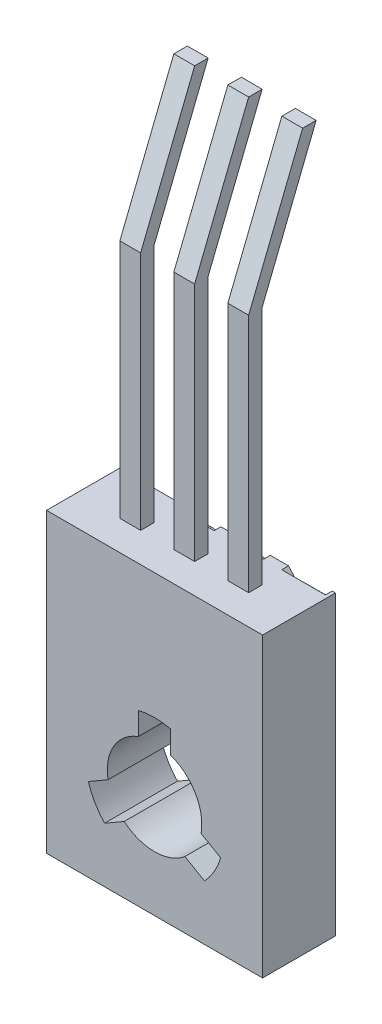
from build123d import *

# Parameters (mm, degrees)
SKETCH1_W           = 8
SKETCH1_H           = 11
SKETCH1_R           = 2.555
BOSS_EXTRUDE1_DEPTH = 1.35
SKETCH2_W           = 0.77
SKETCH2_H           = 0.5
BOSS_EXTRUDE2_DEPTH = 8.9
BOSS_EXTRUDE3_DEPTH = 2.7
CUT_EXTRUDE1_DEPTH  = 0.25
SKETCH8_W           = 0.77
SKETCH8_H           = 0.5


with BuildPart() as part:
    # Sketch1 → Boss-Extrude1 (new, symmetric)
    with BuildSketch(Plane.XY):
        Rectangle(SKETCH1_W, SKETCH1_H)
        with Locations(Location((0, -1.7, 0), (0, 0, 180))):
            Circle(SKETCH1_R, mode=Mode.SUBTRACT)
    extrude(amount=BOSS_EXTRUDE1_DEPTH, both=True)

    # Sketch2 → Boss-Extrude2 (add)
    with BuildSketch(Plane(origin=(0, 5.5, 0), x_dir=(1, 0, 0), z_dir=(0, 1, 0))):
        Rectangle(SKETCH2_W, SKETCH2_H)
        with Locations((-2, 0)):
            Rectangle(SKETCH2_W, SKETCH2_H)
        with Locations((2, 0)):
            Rectangle(SKETCH2_W, SKETCH2_H)
    extrude(amount=BOSS_EXTRUDE2_DEPTH)

    # Sketch4 → Boss-Extrude3 (add)
    with BuildSketch(Plane.XY.offset(1.35)):
        with BuildLine():
            Line((-0.6, 0.823242633), (-0.6, -0.056071778))
            ThreePointArc((-0.6, -0.056071778), (-1.515544457, -0.825), (-1.723683602, -2.002348869))
            Line((-1.723683602, -2.002348869), (-2.48519222, -2.442006074))
            ThreePointArc((-2.48519222, -2.442006074), (-2.246122223, -0.40320073), (-0.6, 0.823242633))
        make_face()
        with BuildLine():
            Line((0.6, 0.823242633), (0.6, -0.056071778))
            ThreePointArc((0.6, -0.056071778), (1.515544457, -0.825), (1.723683602, -2.002348869))
            Line((1.723683602, -2.002348869), (2.48519222, -2.442006074))
            ThreePointArc((2.48519222, -2.442006074), (2.246122223, -0.40320073), (0.6, 0.823242633))
        make_face()
        with BuildLine():
            Line((1.88519222, -3.481236559), (1.123683602, -3.041579353))
            ThreePointArc((1.123683602, -3.041579353), (0, -3.45), (-1.123683602, -3.041579353))
            Line((-1.123683602, -3.041579353), (-1.88519222, -3.481236559))
            ThreePointArc((-1.88519222, -3.481236559), (0, -4.29359854), (1.88519222, -3.481236559))
        make_face()
    extrude(amount=-BOSS_EXTRUDE3_DEPTH)

    # Sketch5 → Cut-Extrude1 (cut)
    # profile 1 of 4: a face of its own
    with BuildSketch(Plane(origin=(0, 0, -1.35), x_dir=(-1, 0, 0), z_dir=(0, 0, -1))):
        with BuildLine():
            Line((-2.565144231, 3.851442308), (-2.351442308, 3.851442308))
            add(Edge.make_bspline(
                [(-2.351442308, 3.851442308), (-2.352834866, 3.823091082), (-2.355569813, 3.767410029), (-2.368383128, 3.686229134), (-2.386700406, 3.60862398), (-2.412660261, 3.535259888), (-2.444718414, 3.465260463), (-2.48396687, 3.399555216), (-2.529568916, 3.337492029), (-2.581440894, 3.280245966), (-2.63772677, 3.227915907), (-2.698089305, 3.182248012), (-2.761908087, 3.14410457), (-2.828629577, 3.112044128), (-2.899025431, 3.088008093), (-2.972422742, 3.070165916), (-3.049153259, 3.059432938), (-3.101431858, 3.05827912), (-3.128019832, 3.057692308)],
                knots=[0, 0, 0, 0, 1.100776268, 2.161895295, 3.184016182, 4.190939212, 5.176500551, 6.166955529, 7.155448256, 8.160289653, 9.16017456, 10.133824356, 11.091467644, 12.04088621, 13.000931625, 13.972173743, 14.968683325, 16, 16, 16, 16], degree=3))
            add(Edge.make_bspline(
                [(-3.128019832, 3.057692308), (-3.154132466, 3.058298618), (-3.20544286, 3.059489997), (-3.280298343, 3.069875086), (-3.351728426, 3.085789309), (-3.418923594, 3.10937168), (-3.482573456, 3.138962397), (-3.541889923, 3.175762331), (-3.598307328, 3.218030232), (-3.649056804, 3.267887294), (-3.695676319, 3.321084906), (-3.735859523, 3.377899507), (-3.770465614, 3.436647555), (-3.798789619, 3.497787956), (-3.820260474, 3.561519813), (-3.83616832, 3.627232108), (-3.845262104, 3.695683204), (-3.846650102, 3.742021319), (-3.847355769, 3.765579928)],
                knots=[0, 0, 0, 0, 1.111674182, 2.184400057, 3.212814286, 4.223731311, 5.211378316, 6.196328225, 7.191884489, 8.207283132, 9.220262353, 10.201199469, 11.166417575, 12.120932471, 13.06540007, 14.026332106, 14.996573967, 16, 16, 16, 16], degree=3))
            add(Edge.make_bspline(
                [(-3.847355769, 3.765579928), (-3.846203728, 3.798745851), (-3.843919861, 3.864495682), (-3.824384095, 3.961116718), (-3.793871441, 4.054728587), (-3.757137209, 4.130072069), (-3.720069206, 4.190776967), (-3.686698963, 4.240783057), (-3.647411405, 4.294612004), (-3.602542189, 4.352481678), (-3.551318603, 4.413634228), (-3.495071429, 4.47931733), (-3.432348063, 4.548316458), (-3.388363905, 4.595474494), (-3.365572416, 4.619910607)],
                knots=[0, 0, 0, 0, 1.184416499, 2.348048165, 3.509039915, 4.696071444, 5.333504901, 6.05069495, 6.844171097, 7.714965912, 8.667477798, 9.695072654, 10.805644396, 12, 12, 12, 12], degree=3))
            Line((-3.365572416, 4.619910607), (-2.769782903, 5.255769231))
            Line((-2.769782903, 5.255769231), (-3.877884615, 5.255769231))
            Line((-3.877884615, 5.255769231), (-3.877884615, 5.5))
            Line((-3.877884615, 5.5), (-2.259855769, 5.5))
            Line((-2.259855769, 5.5), (-3.183353365, 4.514490685))
            add(Edge.make_bspline(
                [(-3.183353365, 4.514490685), (-3.205839323, 4.491020796), (-3.249030246, 4.445939942), (-3.31009352, 4.380103336), (-3.365026379, 4.319097523), (-3.413865261, 4.262652174), (-3.456650353, 4.211087279), (-3.49324476, 4.163998737), (-3.523810223, 4.121790649), (-3.556203245, 4.072206352), (-3.587092141, 4.011595014), (-3.61424032, 3.937897371), (-3.630675458, 3.861863655), (-3.632657075, 3.810497881), (-3.633653846, 3.784660457)],
                knots=[0, 0, 0, 0, 1.329530082, 2.553755191, 3.672934919, 4.687409497, 5.60679272, 6.413407421, 7.126401618, 7.737995624, 8.834647426, 9.90044882, 10.943907757, 12, 12, 12, 12], degree=3))
            add(Edge.make_bspline(
                [(-3.633653846, 3.784660457), (-3.633225757, 3.768410781), (-3.632382076, 3.736385791), (-3.624795144, 3.689462992), (-3.613648436, 3.644024979), (-3.596467914, 3.600633561), (-3.57582615, 3.558435313), (-3.549454774, 3.518713193), (-3.519319217, 3.480113169), (-3.484363448, 3.443958804), (-3.445988509, 3.410835792), (-3.405441819, 3.381496641), (-3.362545574, 3.356977011), (-3.317478542, 3.336876925), (-3.270366917, 3.321109377), (-3.221119432, 3.310183811), (-3.169872201, 3.30332412), (-3.134879055, 3.302395996), (-3.117048528, 3.301923077)],
                knots=[0, 0, 0, 0, 0.991504627, 1.954065223, 2.895985987, 3.842598665, 4.797835564, 5.759220273, 6.74786863, 7.784730864, 8.824135544, 9.839918996, 10.835834653, 11.835434876, 12.84861661, 13.863796685, 14.911511676, 16, 16, 16, 16], degree=3))
            add(Edge.make_bspline(
                [(-3.117048528, 3.301923077), (-3.098421829, 3.302390211), (-3.061842069, 3.303307585), (-3.008250293, 3.310260523), (-2.956767654, 3.320790393), (-2.908187486, 3.33755386), (-2.861493091, 3.357173308), (-2.817875667, 3.382577042), (-2.776109946, 3.411604737), (-2.737035641, 3.445449185), (-2.701447392, 3.48365447), (-2.669072444, 3.525240247), (-2.64164083, 3.570943748), (-2.617290062, 3.619668304), (-2.598666533, 3.672752581), (-2.582744749, 3.728898337), (-2.571179397, 3.78890664), (-2.567189365, 3.830250867), (-2.565144231, 3.851442308)],
                knots=[0, 0, 0, 0, 1.031072318, 2.024855787, 2.988461151, 3.935103592, 4.865765533, 5.788564469, 6.724086513, 7.67908574, 8.64457978, 9.611397706, 10.591395687, 11.591555111, 12.622101007, 13.700900657, 14.821571223, 16, 16, 16, 16], degree=3))
        make_face()
    # profile 2 of 4: a face of its own
    with BuildSketch(Plane(origin=(0, 0, -1.35), x_dir=(-1, 0, 0), z_dir=(0, 0, -1))):
        with BuildLine():
            add(Edge.make_bspline(
                [(-1.585836088, 4.173426232), (-1.605172184, 4.183587539), (-1.643001992, 4.203467473), (-1.696891986, 4.235574187), (-1.747189742, 4.268241646), (-1.792964971, 4.302644376), (-1.834666453, 4.338051095), (-1.872422521, 4.374368116), (-1.906639216, 4.41148058), (-1.936141046, 4.45034258), (-1.962316755, 4.490263035), (-1.984490792, 4.531733955), (-2.003843095, 4.574156078), (-2.019032241, 4.61817346), (-2.031572622, 4.663182243), (-2.040194669, 4.70978637), (-2.044833117, 4.75767258), (-2.045709901, 4.790036052), (-2.046153846, 4.806422776)],
                knots=[0, 0, 0, 0, 1.264219729, 2.473363326, 3.62979159, 4.734286947, 5.785533755, 6.79450939, 7.765315851, 8.704182021, 9.615576613, 10.525715488, 11.423813905, 12.311666436, 13.218214638, 14.126256791, 15.051260205, 16, 16, 16, 16], degree=3))
            add(Edge.make_bspline(
                [(-2.046153846, 4.806422776), (-2.045631946, 4.829350257), (-2.044598911, 4.874732345), (-2.035507403, 4.941696497), (-2.022078043, 5.006995638), (-2.001677559, 5.069889528), (-1.976573795, 5.130914034), (-1.944896164, 5.189246992), (-1.909143855, 5.246562873), (-1.880391485, 5.281816293), (-1.865842849, 5.299654447)],
                knots=[0, 0, 0, 0, 1.02531512, 2.029483338, 3.018748588, 4.004195107, 4.983200899, 5.966616707, 6.971112471, 8, 8, 8, 8], degree=3))
            add(Edge.make_bspline(
                [(-1.865842849, 5.299654447), (-1.846904104, 5.32046914), (-1.809260647, 5.361841313), (-1.744774406, 5.41555606), (-1.674002374, 5.460697344), (-1.597218401, 5.497485544), (-1.514627738, 5.526118959), (-1.426247981, 5.546694672), (-1.331906834, 5.55848011), (-1.267065076, 5.560183718), (-1.233800331, 5.561057692)],
                knots=[0, 0, 0, 0, 0.954267603, 1.896743057, 2.838368354, 3.796610408, 4.779680527, 5.799409237, 6.871065594, 8, 8, 8, 8], degree=3))
            add(Edge.make_bspline(
                [(-1.233800331, 5.561057692), (-1.201815172, 5.560271492), (-1.139575304, 5.558741625), (-1.048970249, 5.548432954), (-0.96440957, 5.530182666), (-0.885492346, 5.505719941), (-0.812981683, 5.473098316), (-0.746745741, 5.433113727), (-0.685813712, 5.386668894), (-0.63209711, 5.332646071), (-0.584420663, 5.274771146), (-0.542503712, 5.215081815), (-0.507859483, 5.153621521), (-0.477998941, 5.09132514), (-0.455776903, 5.026930414), (-0.440015566, 4.96109818), (-0.430115248, 4.894015461), (-0.42879113, 4.848751471), (-0.428125, 4.825980319)],
                knots=[0, 0, 0, 0, 1.256864279, 2.445730223, 3.576845088, 4.651810441, 5.686528262, 6.692706664, 7.686234615, 8.689148594, 9.678739427, 10.630299996, 11.55097961, 12.448208961, 13.341360817, 14.221834469, 15.105450545, 16, 16, 16, 16], degree=3))
            add(Edge.make_bspline(
                [(-0.428125, 4.825980319), (-0.428518262, 4.809271334), (-0.429295486, 4.776248484), (-0.434672214, 4.727459987), (-0.443323664, 4.679975703), (-0.455047176, 4.633608208), (-0.471081126, 4.588602158), (-0.49010311, 4.544725452), (-0.512496551, 4.501979361), (-0.53914324, 4.461014682), (-0.568500984, 4.420380349), (-0.603351327, 4.382094042), (-0.641370815, 4.343906877), (-0.684822763, 4.308141012), (-0.731360445, 4.271841685), (-0.783154269, 4.238042877), (-0.838477219, 4.204106755), (-0.877807424, 4.183828544), (-0.897983023, 4.173426232)],
                knots=[0, 0, 0, 0, 0.941575622, 1.860885767, 2.762557628, 3.660168386, 4.552890429, 5.45184204, 6.353736508, 7.268493418, 8.204037487, 9.175167802, 10.182660057, 11.238220596, 12.344046335, 13.507168087, 14.721227736, 16, 16, 16, 16], degree=3))
            add(Edge.make_bspline(
                [(-0.897983023, 4.173426232), (-0.870400013, 4.158322942), (-0.8170751, 4.129124475), (-0.745792597, 4.076147953), (-0.68541029, 4.01773148), (-0.63656988, 3.953787145), (-0.598007903, 3.886416575), (-0.570744146, 3.815974443), (-0.552948469, 3.743246411), (-0.55114575, 3.693653113), (-0.550240385, 3.668746244)],
                knots=[0, 0, 0, 0, 1.16701039, 2.256125286, 3.287752239, 4.277689688, 5.235169525, 6.160862735, 7.076343936, 8, 8, 8, 8], degree=3))
            add(Edge.make_bspline(
                [(-0.550240385, 3.668746244), (-0.551355031, 3.643371755), (-0.553595664, 3.592364606), (-0.571651427, 3.516414554), (-0.601298039, 3.441778548), (-0.640931145, 3.368629548), (-0.69136917, 3.300300664), (-0.751069622, 3.238521516), (-0.819957403, 3.184891014), (-0.896518382, 3.139555613), (-0.978761497, 3.102481252), (-1.065681667, 3.077171143), (-1.15572976, 3.060524663), (-1.217029532, 3.058645242), (-1.248110727, 3.057692308)],
                knots=[0, 0, 0, 0, 0.888724595, 1.786491426, 2.720083884, 3.697804067, 4.69440576, 5.687697823, 6.7000873, 7.744853364, 8.800284131, 9.853047784, 10.91141782, 12, 12, 12, 12], degree=3))
            add(Edge.make_bspline(
                [(-1.248110727, 3.057692308), (-1.278390346, 3.058672086), (-1.338098304, 3.060604097), (-1.425993938, 3.076876742), (-1.510165556, 3.10375002), (-1.590141408, 3.140351523), (-1.66421978, 3.185958066), (-1.730142675, 3.240178765), (-1.788448254, 3.301284757), (-1.836619187, 3.369839004), (-1.87526245, 3.442983127), (-1.903090051, 3.518857729), (-1.920682886, 3.596553192), (-1.922918412, 3.649098193), (-1.924038462, 3.675424429)],
                knots=[0, 0, 0, 0, 1.072634126, 2.115112298, 3.156050586, 4.19761425, 5.225177188, 6.230426315, 7.215180151, 8.209739481, 9.190420596, 10.139012357, 11.067603024, 12, 12, 12, 12], degree=3))
            add(Edge.make_bspline(
                [(-1.924038462, 3.675424429), (-1.923056544, 3.701259855), (-1.921128113, 3.751999164), (-1.905119462, 3.825858747), (-1.8777397, 3.894886533), (-1.840804315, 3.96014471), (-1.79232578, 4.020590457), (-1.733282922, 4.076523967), (-1.66444189, 4.129039184), (-1.612623717, 4.15829982), (-1.585836088, 4.173426232)],
                knots=[0, 0, 0, 0, 0.975463758, 1.915755378, 2.838359076, 3.772025586, 4.738400888, 5.753889765, 6.838863581, 8, 8, 8, 8], degree=3))
        make_face()
        with BuildLine():
            add(Edge.make_bspline(
                [(-1.236185397, 3.301923077), (-1.219481497, 3.302364854), (-1.186801365, 3.303229164), (-1.138892892, 3.307779512), (-1.093298345, 3.316520017), (-1.049768396, 3.328494392), (-1.008153928, 3.343392912), (-0.969409235, 3.363022221), (-0.932232274, 3.384840279), (-0.89784267, 3.410431869), (-0.866711346, 3.438352846), (-0.838905585, 3.467511909), (-0.816252521, 3.498768653), (-0.796763258, 3.530559346), (-0.782289759, 3.564202586), (-0.772008284, 3.598961743), (-0.764732004, 3.635056981), (-0.764207586, 3.659646622), (-0.763942308, 3.672085337)],
                knots=[0, 0, 0, 0, 1.20353747, 2.354645537, 3.462130888, 4.543058862, 5.604822423, 6.639552563, 7.666902586, 8.706944258, 9.720926464, 10.677177239, 11.602682187, 12.496457588, 13.358248655, 14.231532794, 15.105417644, 16, 16, 16, 16], degree=3))
            add(Edge.make_bspline(
                [(-0.763942308, 3.672085337), (-0.764426113, 3.684517008), (-0.765382181, 3.709083777), (-0.772302234, 3.745507441), (-0.783872622, 3.780834886), (-0.799738112, 3.815395902), (-0.820098498, 3.849101779), (-0.844809926, 3.882081675), (-0.874944619, 3.913463463), (-0.908222414, 3.944137505), (-0.944572517, 3.972397954), (-0.982769862, 3.997641733), (-1.023093217, 4.017765852), (-1.06433499, 4.035410592), (-1.107367349, 4.048646192), (-1.15189358, 4.058181663), (-1.197866122, 4.064079946), (-1.229012739, 4.064786662), (-1.244771635, 4.065144231)],
                knots=[0, 0, 0, 0, 0.873213166, 1.72559466, 2.594724523, 3.479581045, 4.391597569, 5.35687048, 6.368548091, 7.443976143, 8.534559525, 9.600545123, 10.654815915, 11.696401765, 12.749428718, 13.812189468, 14.893058657, 16, 16, 16, 16], degree=3))
            add(Edge.make_bspline(
                [(-1.244771635, 4.065144231), (-1.265013542, 4.064553364), (-1.305297429, 4.063377467), (-1.364660625, 4.052344616), (-1.422526027, 4.035209555), (-1.477798721, 4.010889433), (-1.529489457, 3.981237361), (-1.576140343, 3.94626927), (-1.615799126, 3.90516396), (-1.649538657, 3.860305852), (-1.675918194, 3.812722236), (-1.696125332, 3.764775474), (-1.708025553, 3.716070631), (-1.709572484, 3.683434642), (-1.710336538, 3.667315204)],
                knots=[0, 0, 0, 0, 1.076561449, 2.142489767, 3.202892658, 4.283174188, 5.348766409, 6.369549039, 7.375093932, 8.378927502, 9.349008457, 10.26378795, 11.142457041, 12, 12, 12, 12], degree=3))
            add(Edge.make_bspline(
                [(-1.710336538, 3.667315204), (-1.709981352, 3.655999829), (-1.709276356, 3.63354043), (-1.703231445, 3.600265354), (-1.69380323, 3.567726527), (-1.680060274, 3.53611497), (-1.663435576, 3.504696317), (-1.642244485, 3.4744562), (-1.61768522, 3.444479468), (-1.589403232, 3.415752822), (-1.557450419, 3.388783475), (-1.521568308, 3.365405276), (-1.482073546, 3.345910458), (-1.439495622, 3.329532403), (-1.39338458, 3.317368284), (-1.344137425, 3.308214342), (-1.291309797, 3.303065474), (-1.254958723, 3.302312135), (-1.236185397, 3.301923077)],
                knots=[0, 0, 0, 0, 0.814035228, 1.61574325, 2.427118093, 3.24780647, 4.092880925, 4.981933388, 5.900917883, 6.880367106, 7.87994501, 8.905470125, 9.95492938, 11.0455354, 12.184050453, 13.382997595, 14.64846247, 16, 16, 16, 16], degree=3))
        make_face(mode=Mode.SUBTRACT)
        with BuildLine():
            add(Edge.make_bspline(
                [(-1.25001878, 4.309375), (-1.228842188, 4.309751781), (-1.18729888, 4.310490935), (-1.126435398, 4.31871459), (-1.068027577, 4.330170132), (-1.012254718, 4.347520158), (-0.959403111, 4.370094899), (-0.908728966, 4.396864676), (-0.861025827, 4.428950898), (-0.81650691, 4.46557551), (-0.775748647, 4.505264722), (-0.739860426, 4.547181831), (-0.709539968, 4.590757656), (-0.684934576, 4.636047312), (-0.665846364, 4.682951014), (-0.651758969, 4.731496133), (-0.643579846, 4.781818079), (-0.642414489, 4.815934329), (-0.641826923, 4.833135517)],
                knots=[0, 0, 0, 0, 1.140332253, 2.237053636, 3.304055028, 4.344690294, 5.377465719, 6.397042765, 7.428360044, 8.469453732, 9.499453352, 10.490108612, 11.438398528, 12.354680514, 13.261581007, 14.161901135, 15.073242693, 16, 16, 16, 16], degree=3))
            add(Edge.make_bspline(
                [(-0.641826923, 4.833135517), (-0.642771565, 4.854516022), (-0.644652574, 4.897089713), (-0.659040073, 4.959850893), (-0.682668507, 5.020592568), (-0.715816413, 5.078458073), (-0.756249108, 5.132745813), (-0.805402936, 5.180732742), (-0.862079475, 5.221772883), (-0.925813099, 5.256074021), (-0.99567763, 5.283240988), (-1.071241319, 5.302677098), (-1.151992321, 5.314893515), (-1.207678773, 5.316172298), (-1.236185397, 5.316826923)],
                knots=[0, 0, 0, 0, 0.899105568, 1.790333855, 2.694925079, 3.632758987, 4.588257081, 5.534574046, 6.511571685, 7.523527334, 8.572244311, 9.657983075, 10.801090915, 12, 12, 12, 12], degree=3))
            add(Edge.make_bspline(
                [(-1.236185397, 5.316826923), (-1.258465799, 5.316394113), (-1.301875167, 5.315550859), (-1.365228248, 5.308262465), (-1.424873604, 5.296357044), (-1.481382653, 5.28021457), (-1.534334788, 5.258816306), (-1.583657833, 5.23223761), (-1.630023433, 5.201878996), (-1.671450011, 5.165937021), (-1.709116956, 5.127476885), (-1.74211023, 5.086977091), (-1.770032686, 5.044843246), (-1.792540868, 5.001100015), (-1.810414515, 4.95590815), (-1.823299379, 4.909082139), (-1.831240684, 4.860438054), (-1.832044482, 4.827441609), (-1.832451923, 4.810715895)],
                knots=[0, 0, 0, 0, 1.224631902, 2.385975653, 3.500340538, 4.565441647, 5.612488581, 6.63322211, 7.641830068, 8.652595074, 9.641693811, 10.598750962, 11.520088299, 12.415429315, 13.298523938, 14.187139574, 15.081071174, 16, 16, 16, 16], degree=3))
            add(Edge.make_bspline(
                [(-1.832451923, 4.810715895), (-1.831839694, 4.794468926), (-1.830632486, 4.762432742), (-1.822860434, 4.714993415), (-1.809518391, 4.668973249), (-1.790063442, 4.624579806), (-1.766171777, 4.581296675), (-1.736657948, 4.539487225), (-1.701881667, 4.499035686), (-1.661928058, 4.460774912), (-1.618627368, 4.425404563), (-1.572738091, 4.393971705), (-1.524051095, 4.368281343), (-1.47353085, 4.346699629), (-1.420668067, 4.329880862), (-1.365717721, 4.318087321), (-1.308575711, 4.310675089), (-1.269758274, 4.309813259), (-1.25001878, 4.309375)],
                knots=[0, 0, 0, 0, 0.917336384, 1.808827106, 2.706624561, 3.615530867, 4.539869921, 5.493819324, 6.499753197, 7.547410123, 8.613069608, 9.653934021, 10.682176708, 11.716048074, 12.752411263, 13.808993382, 14.885826486, 16, 16, 16, 16], degree=3))
        make_face(mode=Mode.SUBTRACT)
    # profile 3 of 4: a face of its own
    with BuildSketch(Plane(origin=(0, 0, -1.35), x_dir=(-1, 0, 0), z_dir=(0, 0, -1))):
        with BuildLine():
            add(Edge.make_bspline(
                [(0.245894681, 4.173426232), (0.226558586, 4.183587539), (0.188728777, 4.203467473), (0.134838783, 4.235574187), (0.084541027, 4.268241646), (0.038765798, 4.302644376), (-0.002935684, 4.338051095), (-0.040691752, 4.374368116), (-0.074908447, 4.41148058), (-0.104410276, 4.45034258), (-0.130585986, 4.490263035), (-0.152760023, 4.531733955), (-0.172112325, 4.574156078), (-0.187301472, 4.61817346), (-0.199841853, 4.663182243), (-0.208463899, 4.70978637), (-0.213102348, 4.75767258), (-0.213979132, 4.790036052), (-0.214423077, 4.806422776)],
                knots=[0, 0, 0, 0, 1.264219729, 2.473363326, 3.62979159, 4.734286947, 5.785533755, 6.79450939, 7.765315851, 8.704182021, 9.615576613, 10.525715488, 11.423813905, 12.311666436, 13.218214638, 14.126256791, 15.051260205, 16, 16, 16, 16], degree=3))
            add(Edge.make_bspline(
                [(-0.214423077, 4.806422776), (-0.213901177, 4.829350257), (-0.212868142, 4.874732345), (-0.203776634, 4.941696497), (-0.190347274, 5.006995638), (-0.16994679, 5.069889528), (-0.144843026, 5.130914034), (-0.113165395, 5.189246992), (-0.077413086, 5.246562873), (-0.048660716, 5.281816293), (-0.034112079, 5.299654447)],
                knots=[0, 0, 0, 0, 1.02531512, 2.029483338, 3.018748588, 4.004195107, 4.983200899, 5.966616707, 6.971112471, 8, 8, 8, 8], degree=3))
            add(Edge.make_bspline(
                [(-0.034112079, 5.299654447), (-0.015173335, 5.32046914), (0.022470122, 5.361841313), (0.086956364, 5.41555606), (0.157728395, 5.460697344), (0.234512368, 5.497485544), (0.317103032, 5.526118959), (0.405482788, 5.546694672), (0.499823935, 5.55848011), (0.564665693, 5.560183718), (0.597930439, 5.561057692)],
                knots=[0, 0, 0, 0, 0.954267603, 1.896743057, 2.838368354, 3.796610408, 4.779680527, 5.799409237, 6.871065594, 8, 8, 8, 8], degree=3))
            add(Edge.make_bspline(
                [(0.597930439, 5.561057692), (0.629915597, 5.560271492), (0.692155466, 5.558741625), (0.78276052, 5.548432954), (0.867321199, 5.530182666), (0.946238423, 5.505719941), (1.018749086, 5.473098316), (1.084985028, 5.433113727), (1.145917057, 5.386668894), (1.199633659, 5.332646071), (1.247310106, 5.274771146), (1.289227057, 5.215081815), (1.323871286, 5.153621521), (1.353731828, 5.09132514), (1.375953866, 5.026930414), (1.391715203, 4.96109818), (1.401615521, 4.894015461), (1.402939639, 4.848751471), (1.403605769, 4.825980319)],
                knots=[0, 0, 0, 0, 1.256864279, 2.445730223, 3.576845088, 4.651810441, 5.686528262, 6.692706664, 7.686234615, 8.689148594, 9.678739427, 10.630299996, 11.55097961, 12.448208961, 13.341360817, 14.221834469, 15.105450545, 16, 16, 16, 16], degree=3))
            add(Edge.make_bspline(
                [(1.403605769, 4.825980319), (1.403212507, 4.809271334), (1.402435283, 4.776248484), (1.397058556, 4.727459987), (1.388407105, 4.679975703), (1.376683593, 4.633608208), (1.360649643, 4.588602158), (1.341627659, 4.544725452), (1.319234219, 4.501979361), (1.292587529, 4.461014682), (1.263229785, 4.420380349), (1.228379443, 4.382094042), (1.190359954, 4.343906877), (1.146908006, 4.308141012), (1.100370324, 4.271841685), (1.0485765, 4.238042877), (0.99325355, 4.204106755), (0.953923345, 4.183828544), (0.933747746, 4.173426232)],
                knots=[0, 0, 0, 0, 0.941575622, 1.860885767, 2.762557628, 3.660168386, 4.552890429, 5.45184204, 6.353736508, 7.268493418, 8.204037487, 9.175167802, 10.182660057, 11.238220596, 12.344046335, 13.507168087, 14.721227736, 16, 16, 16, 16], degree=3))
            add(Edge.make_bspline(
                [(0.933747746, 4.173426232), (0.961330757, 4.158322942), (1.014655669, 4.129124475), (1.085938172, 4.076147953), (1.14632048, 4.01773148), (1.195160889, 3.953787145), (1.233722866, 3.886416575), (1.260986623, 3.815974443), (1.2787823, 3.743246411), (1.280585019, 3.693653113), (1.281490385, 3.668746244)],
                knots=[0, 0, 0, 0, 1.16701039, 2.256125286, 3.287752239, 4.277689688, 5.235169525, 6.160862735, 7.076343936, 8, 8, 8, 8], degree=3))
            add(Edge.make_bspline(
                [(1.281490385, 3.668746244), (1.280375738, 3.643371755), (1.278135105, 3.592364606), (1.260079342, 3.516414554), (1.230432731, 3.441778548), (1.190799625, 3.368629548), (1.140361599, 3.300300664), (1.080661147, 3.238521516), (1.011773366, 3.184891014), (0.935212387, 3.139555613), (0.852969272, 3.102481252), (0.766049103, 3.077171143), (0.67600101, 3.060524663), (0.614701237, 3.058645242), (0.583620042, 3.057692308)],
                knots=[0, 0, 0, 0, 0.888724595, 1.786491426, 2.720083884, 3.697804067, 4.69440576, 5.687697823, 6.7000873, 7.744853364, 8.800284131, 9.853047784, 10.91141782, 12, 12, 12, 12], degree=3))
            add(Edge.make_bspline(
                [(0.583620042, 3.057692308), (0.553340424, 3.058672086), (0.493632466, 3.060604097), (0.405736831, 3.076876742), (0.321565214, 3.10375002), (0.241589362, 3.140351523), (0.167510989, 3.185958066), (0.101588095, 3.240178765), (0.043282515, 3.301284757), (-0.004888418, 3.369839004), (-0.043531681, 3.442983127), (-0.071359281, 3.518857729), (-0.088952117, 3.596553192), (-0.091187643, 3.649098193), (-0.092307692, 3.675424429)],
                knots=[0, 0, 0, 0, 1.072634126, 2.115112298, 3.156050586, 4.19761425, 5.225177188, 6.230426315, 7.215180151, 8.209739481, 9.190420596, 10.139012357, 11.067603024, 12, 12, 12, 12], degree=3))
            add(Edge.make_bspline(
                [(-0.092307692, 3.675424429), (-0.091325774, 3.701259855), (-0.089397343, 3.751999164), (-0.073388693, 3.825858747), (-0.046008931, 3.894886533), (-0.009073546, 3.96014471), (0.03940499, 4.020590457), (0.098447848, 4.076523967), (0.167288879, 4.129039184), (0.219107052, 4.15829982), (0.245894681, 4.173426232)],
                knots=[0, 0, 0, 0, 0.975463758, 1.915755378, 2.838359076, 3.772025586, 4.738400888, 5.753889765, 6.838863581, 8, 8, 8, 8], degree=3))
        make_face()
        with BuildLine():
            add(Edge.make_bspline(
                [(0.595545373, 3.301923077), (0.612249272, 3.302364854), (0.644929404, 3.303229164), (0.692837878, 3.307779512), (0.738432424, 3.316520017), (0.781962373, 3.328494392), (0.823576841, 3.343392912), (0.862321534, 3.363022221), (0.899498495, 3.384840279), (0.9338881, 3.410431869), (0.965019423, 3.438352846), (0.992825184, 3.467511909), (1.015478249, 3.498768653), (1.034967511, 3.530559346), (1.049441011, 3.564202586), (1.059722486, 3.598961743), (1.066998765, 3.635056981), (1.067523184, 3.659646622), (1.067788462, 3.672085337)],
                knots=[0, 0, 0, 0, 1.20353747, 2.354645537, 3.462130888, 4.543058862, 5.604822423, 6.639552563, 7.666902586, 8.706944258, 9.720926464, 10.677177239, 11.602682187, 12.496457588, 13.358248655, 14.231532794, 15.105417644, 16, 16, 16, 16], degree=3))
            add(Edge.make_bspline(
                [(1.067788462, 3.672085337), (1.067304657, 3.684517008), (1.066348588, 3.709083777), (1.059428535, 3.745507441), (1.047858147, 3.780834886), (1.031992657, 3.815395902), (1.011632271, 3.849101779), (0.986920843, 3.882081675), (0.95678615, 3.913463463), (0.923508355, 3.944137505), (0.887158252, 3.972397954), (0.848960907, 3.997641733), (0.808637552, 4.017765852), (0.767395779, 4.035410592), (0.72436342, 4.048646192), (0.679837189, 4.058181663), (0.633864647, 4.064079946), (0.60271803, 4.064786662), (0.586959135, 4.065144231)],
                knots=[0, 0, 0, 0, 0.873213166, 1.72559466, 2.594724523, 3.479581045, 4.391597569, 5.35687048, 6.368548091, 7.443976143, 8.534559525, 9.600545123, 10.654815915, 11.696401765, 12.749428718, 13.812189468, 14.893058657, 16, 16, 16, 16], degree=3))
            add(Edge.make_bspline(
                [(0.586959135, 4.065144231), (0.566717227, 4.064553364), (0.52643334, 4.063377467), (0.467070144, 4.052344616), (0.409204742, 4.035209555), (0.353932048, 4.010889433), (0.302241312, 3.981237361), (0.255590426, 3.94626927), (0.215931644, 3.90516396), (0.182192112, 3.860305852), (0.155812575, 3.812722236), (0.135605437, 3.764775474), (0.123705216, 3.716070631), (0.122158285, 3.683434642), (0.121394231, 3.667315204)],
                knots=[0, 0, 0, 0, 1.076561449, 2.142489767, 3.202892658, 4.283174188, 5.348766409, 6.369549039, 7.375093932, 8.378927502, 9.349008457, 10.26378795, 11.142457041, 12, 12, 12, 12], degree=3))
            add(Edge.make_bspline(
                [(0.121394231, 3.667315204), (0.121749418, 3.655999829), (0.122454413, 3.63354043), (0.128499324, 3.600265354), (0.137927539, 3.567726527), (0.151670495, 3.53611497), (0.168295194, 3.504696317), (0.189486284, 3.4744562), (0.214045549, 3.444479468), (0.242327537, 3.415752822), (0.27428035, 3.388783475), (0.310162461, 3.365405276), (0.349657223, 3.345910458), (0.392235147, 3.329532403), (0.438346189, 3.317368284), (0.487593344, 3.308214342), (0.540420972, 3.303065474), (0.576772046, 3.302312135), (0.595545373, 3.301923077)],
                knots=[0, 0, 0, 0, 0.814035228, 1.61574325, 2.427118093, 3.24780647, 4.092880925, 4.981933388, 5.900917883, 6.880367106, 7.87994501, 8.905470125, 9.95492938, 11.0455354, 12.184050453, 13.382997595, 14.64846247, 16, 16, 16, 16], degree=3))
        make_face(mode=Mode.SUBTRACT)
        with BuildLine():
            add(Edge.make_bspline(
                [(0.581711989, 4.309375), (0.602888582, 4.309751781), (0.644431889, 4.310490935), (0.705295371, 4.31871459), (0.763703192, 4.330170132), (0.819476052, 4.347520158), (0.872327658, 4.370094899), (0.923001803, 4.396864676), (0.970704942, 4.428950898), (1.015223859, 4.46557551), (1.055982123, 4.505264722), (1.091870343, 4.547181831), (1.122190801, 4.590757656), (1.146796193, 4.636047312), (1.165884405, 4.682951014), (1.1799718, 4.731496133), (1.188150923, 4.781818079), (1.18931628, 4.815934329), (1.189903846, 4.833135517)],
                knots=[0, 0, 0, 0, 1.140332253, 2.237053636, 3.304055028, 4.344690294, 5.377465719, 6.397042765, 7.428360044, 8.469453732, 9.499453352, 10.490108612, 11.438398528, 12.354680514, 13.261581007, 14.161901135, 15.073242693, 16, 16, 16, 16], degree=3))
            add(Edge.make_bspline(
                [(1.189903846, 4.833135517), (1.188959204, 4.854516022), (1.187078195, 4.897089713), (1.172690696, 4.959850893), (1.149062263, 5.020592568), (1.115914356, 5.078458073), (1.075481661, 5.132745813), (1.026327833, 5.180732742), (0.969651294, 5.221772883), (0.90591767, 5.256074021), (0.836053139, 5.283240988), (0.760489451, 5.302677098), (0.679738449, 5.314893515), (0.624051996, 5.316172298), (0.595545373, 5.316826923)],
                knots=[0, 0, 0, 0, 0.899105568, 1.790333855, 2.694925079, 3.632758987, 4.588257081, 5.534574046, 6.511571685, 7.523527334, 8.572244311, 9.657983075, 10.801090915, 12, 12, 12, 12], degree=3))
            add(Edge.make_bspline(
                [(0.595545373, 5.316826923), (0.573264971, 5.316394113), (0.529855603, 5.315550859), (0.466502521, 5.308262465), (0.406857166, 5.296357044), (0.350348116, 5.28021457), (0.297395981, 5.258816306), (0.248072936, 5.23223761), (0.201707336, 5.201878996), (0.160280758, 5.165937021), (0.122613814, 5.127476885), (0.089620539, 5.086977091), (0.061698083, 5.044843246), (0.039189901, 5.001100015), (0.021316254, 4.95590815), (0.00843139, 4.909082139), (0.000490085, 4.860438054), (-0.000313713, 4.827441609), (-0.000721154, 4.810715895)],
                knots=[0, 0, 0, 0, 1.224631902, 2.385975653, 3.500340538, 4.565441647, 5.612488581, 6.63322211, 7.641830068, 8.652595074, 9.641693811, 10.598750962, 11.520088299, 12.415429315, 13.298523938, 14.187139574, 15.081071174, 16, 16, 16, 16], degree=3))
            add(Edge.make_bspline(
                [(-0.000721154, 4.810715895), (-0.000108925, 4.794468926), (0.001098283, 4.762432742), (0.008870335, 4.714993415), (0.022212378, 4.668973249), (0.041667327, 4.624579806), (0.065558992, 4.581296675), (0.095072822, 4.539487225), (0.129849102, 4.499035686), (0.169802711, 4.460774912), (0.213103401, 4.425404563), (0.258992678, 4.393971705), (0.307679674, 4.368281343), (0.35819992, 4.346699629), (0.411062703, 4.329880862), (0.466013049, 4.318087321), (0.523155058, 4.310675089), (0.561972496, 4.309813259), (0.581711989, 4.309375)],
                knots=[0, 0, 0, 0, 0.917336384, 1.808827106, 2.706624561, 3.615530867, 4.539869921, 5.493819324, 6.499753197, 7.547410123, 8.613069608, 9.653934021, 10.682176708, 11.716048074, 12.752411263, 13.808993382, 14.885826486, 16, 16, 16, 16], degree=3))
        make_face(mode=Mode.SUBTRACT)
    # profile 4 of 4: a face of its own
    with BuildSketch(Plane(origin=(0, 0, -1.35), x_dir=(-1, 0, 0), z_dir=(0, 0, -1))):
        with BuildLine():
            Line((3.632211538, 5.5), (3.632211538, 3.11875))
            Line((3.632211538, 3.11875), (3.151382212, 3.11875))
            add(Edge.make_bspline(
                [(3.151382212, 3.11875), (3.109561259, 3.119050285), (3.028763398, 3.119630435), (2.912006808, 3.123329907), (2.804131222, 3.1298082), (2.705197901, 3.139426621), (2.615047901, 3.150971422), (2.533825607, 3.165653527), (2.461399393, 3.182920676), (2.416856879, 3.197648006), (2.395793269, 3.20461238)],
                knots=[0, 0, 0, 0, 1.314317071, 2.539253741, 3.67075822, 4.709970291, 5.662644612, 6.526156501, 7.303037452, 8, 8, 8, 8], degree=3))
            add(Edge.make_bspline(
                [(2.395793269, 3.20461238), (2.36823992, 3.215107513), (2.313758041, 3.235859785), (2.236228248, 3.275065916), (2.162995079, 3.319306538), (2.094636788, 3.369595937), (2.031002749, 3.425291472), (1.971292309, 3.485942522), (1.917216957, 3.553168265), (1.866911617, 3.624882712), (1.822881392, 3.701738479), (1.784055195, 3.782196155), (1.750903518, 3.866099629), (1.725036305, 3.954061105), (1.703665516, 4.045235749), (1.689326242, 4.140313863), (1.679801238, 4.238741136), (1.678848698, 4.305535693), (1.678365385, 4.339426833)],
                knots=[0, 0, 0, 0, 0.984696416, 1.947063185, 2.89840987, 3.841051395, 4.778753227, 5.721858861, 6.681155121, 7.65838316, 8.646299769, 9.637283673, 10.641736726, 11.657050558, 12.698485921, 13.768600492, 14.86780186, 16, 16, 16, 16], degree=3))
            add(Edge.make_bspline(
                [(1.678365385, 4.339426833), (1.678793596, 4.368859826), (1.679637431, 4.426860612), (1.687205208, 4.512342722), (1.698225983, 4.59528227), (1.71521022, 4.67531508), (1.736080056, 4.752979988), (1.761838755, 4.827909262), (1.792369353, 4.90015383), (1.827776176, 4.969139873), (1.866545203, 5.034699642), (1.908790422, 5.095794384), (1.953065384, 5.153097695), (2.000984876, 5.205315031), (2.050962335, 5.254072454), (2.104697561, 5.29720708), (2.160508042, 5.336721427), (2.220070486, 5.37141551), (2.283873582, 5.402276929), (2.353583956, 5.428339581), (2.428947185, 5.450768436), (2.510462641, 5.468638212), (2.597858463, 5.483042158), (2.691371561, 5.492634447), (2.790826825, 5.499139216), (2.859120799, 5.499707501), (2.894272085, 5.5)],
                knots=[0, 0, 0, 0, 1.105894396, 2.179280415, 3.222964075, 4.248423888, 5.251546139, 6.243661943, 7.223682738, 8.196462441, 9.155694589, 10.083899862, 10.986397372, 11.874737962, 12.745335529, 13.607670254, 14.461432187, 15.313100333, 16.195087267, 17.121790994, 18.106827133, 19.14775296, 20.255889161, 21.433815148, 22.679170477, 24, 24, 24, 24], degree=3))
            Line((2.894272085, 5.5), (3.632211538, 5.5))
        make_face()
        with BuildLine():
            Line((3.418509615, 5.255769231), (3.14518104, 5.255769231))
            add(Edge.make_bspline(
                [(3.14518104, 5.255769231), (3.10590513, 5.255600437), (3.030363173, 5.255275784), (2.921738714, 5.25242699), (2.822488625, 5.247772029), (2.732598812, 5.241257556), (2.652120029, 5.232638374), (2.580884085, 5.223028395), (2.51912449, 5.211055844), (2.481752855, 5.200203495), (2.464483173, 5.195188552)],
                knots=[0, 0, 0, 0, 1.375205317, 2.645023457, 3.804390687, 4.853969522, 5.800190428, 6.637939096, 7.370582563, 8, 8, 8, 8], degree=3))
            add(Edge.make_bspline(
                [(2.464483173, 5.195188552), (2.442746415, 5.187534046), (2.39979208, 5.172407861), (2.337967164, 5.144805896), (2.280277489, 5.112150644), (2.225761309, 5.07563751), (2.174768982, 5.034702696), (2.127536649, 4.98921602), (2.083691232, 4.939704092), (2.04393474, 4.886000078), (2.007978146, 4.828699853), (1.976911768, 4.767867243), (1.950723162, 4.703843619), (1.929237153, 4.636851731), (1.912485433, 4.566851707), (1.900691563, 4.493667883), (1.89338304, 4.417329158), (1.892510667, 4.36536113), (1.892067308, 4.33894982)],
                knots=[0, 0, 0, 0, 0.998420628, 1.972994, 2.929372424, 3.86770908, 4.81360496, 5.759023883, 6.706048443, 7.676227424, 8.651287839, 9.634325482, 10.632389399, 11.645655052, 12.680158286, 13.74837235, 14.855672678, 16, 16, 16, 16], degree=3))
            add(Edge.make_bspline(
                [(1.892067308, 4.33894982), (1.892416899, 4.311100601), (1.893103673, 4.256390564), (1.901721454, 4.176112387), (1.914341846, 4.098913581), (1.932495294, 4.024738566), (1.955947985, 3.953683844), (1.98401103, 3.885347987), (2.018083972, 3.820610412), (2.056658144, 3.758922817), (2.099964717, 3.701219422), (2.147811585, 3.648176252), (2.199694231, 3.599694501), (2.255373544, 3.555696978), (2.315628015, 3.516966118), (2.379438021, 3.482511749), (2.447702409, 3.453237269), (2.495200869, 3.437672613), (2.519339694, 3.42976262)],
                knots=[0, 0, 0, 0, 1.122272916, 2.204715076, 3.251197285, 4.274229216, 5.279697671, 6.265416158, 7.248880903, 8.225321784, 9.195852973, 10.153576302, 11.101466393, 12.055578741, 13.010401466, 13.985536859, 14.976245305, 16, 16, 16, 16], degree=3))
            add(Edge.make_bspline(
                [(2.519339694, 3.42976262), (2.539308956, 3.424240551), (2.581769086, 3.412499115), (2.651056293, 3.399691139), (2.729035528, 3.388394149), (2.816053003, 3.378829662), (2.912009526, 3.371966681), (3.016978896, 3.366815483), (3.131006484, 3.363341149), (3.210052101, 3.363103903), (3.251077975, 3.362980769)],
                knots=[0, 0, 0, 0, 0.674548936, 1.434276114, 2.292660221, 3.240891867, 4.284742987, 5.42552168, 6.663806718, 8, 8, 8, 8], degree=3))
            Line((3.251077975, 3.362980769), (3.418509615, 3.362980769))
            Line((3.418509615, 3.362980769), (3.418509615, 5.255769231))
        make_face(mode=Mode.SUBTRACT)
    extrude(amount=-CUT_EXTRUDE1_DEPTH, mode=Mode.SUBTRACT)

    # Sweep1: sweep along a path in Sketch7
    with BuildLine(Plane(origin=(0, 0, 0), x_dir=(0, 0, -1), z_dir=(1, 0, 0))) as sweep1_path:
        Line((0, 14.4), (1.99985732, 19.4))
    # Sketch8 → Sweep1 (sweep)
    with BuildSketch(Plane(origin=(0, 14.4, 0), x_dir=(1, 0, 0), z_dir=(0, 1, 0))):
        with Locations((2, 0)):
            Rectangle(SKETCH8_W, SKETCH8_H)
        Rectangle(SKETCH8_W, SKETCH8_H)
        with Locations((-2, 0)):
            Rectangle(SKETCH8_W, SKETCH8_H)
    sweep(path=sweep1_path.line)


solid = part.part
